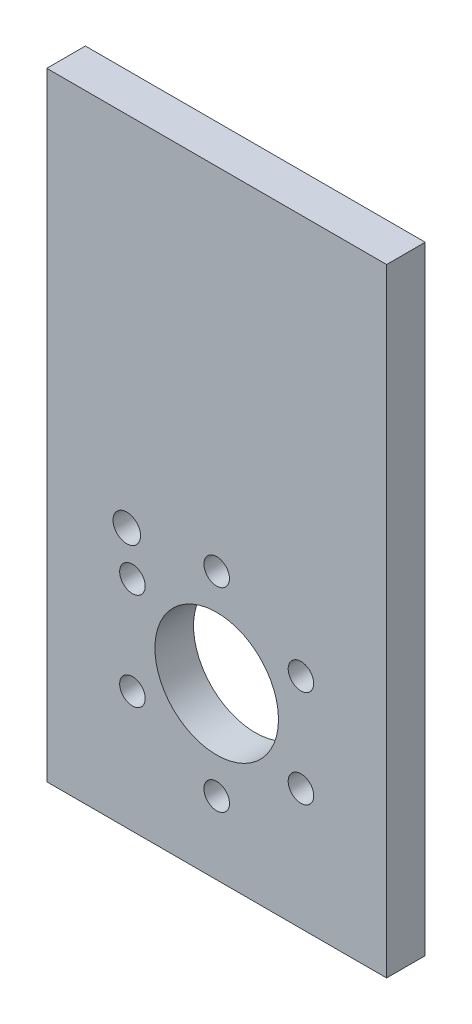
from build123d import *

# Parameters (mm, degrees)
MODEL_W                         = 27.94
MODEL_H                         = 50.8
MODEL_R                         = 1.05
MODEL_R_2                       = 5.08
BOSS_EXTRUDE1_DEPTH             = 3.175
F_43_0_089_DIAMETER_HOLE1_D     = 2.2606
F_43_0_089_DIAMETER_HOLE1_DEPTH = 25.4
F_43_0_089_DIAMETER_HOLE1_TIP   = 0.679152758


with BuildPart() as part:
    # Model → Boss-Extrude1 (new body)
    with BuildSketch(Plane.XY):
        with Locations((0, 11.43)):
            Rectangle(MODEL_W, MODEL_H)
        with Locations((-6.92820323, 4.000000001)):
            Circle(MODEL_R, mode=Mode.SUBTRACT)
        with Locations((-6.92820323, -4.000000001)):
            Circle(MODEL_R, mode=Mode.SUBTRACT)
        with Locations((0, -7.999999999)):
            Circle(MODEL_R, mode=Mode.SUBTRACT)
        with Locations((6.92820323, -4.000000001)):
            Circle(MODEL_R, mode=Mode.SUBTRACT)
        with Locations((6.92820323, 4.000000001)):
            Circle(MODEL_R, mode=Mode.SUBTRACT)
        with Locations((0, 7.999999999)):
            Circle(MODEL_R, mode=Mode.SUBTRACT)
        Circle(MODEL_R_2, mode=Mode.SUBTRACT)
    extrude(amount=BOSS_EXTRUDE1_DEPTH)

    # #43 (0.089) Diameter Hole1
    with Locations(Plane.XY.offset(3.175)):
        with Locations((-7.39143302, 7.395974597)):
            Hole(F_43_0_089_DIAMETER_HOLE1_D / 2, depth=F_43_0_089_DIAMETER_HOLE1_DEPTH)
            with Locations((0, 0, -(F_43_0_089_DIAMETER_HOLE1_DEPTH + F_43_0_089_DIAMETER_HOLE1_TIP / 2))):  # 118° drill point
                Cone(0, F_43_0_089_DIAMETER_HOLE1_D / 2, F_43_0_089_DIAMETER_HOLE1_TIP, mode=Mode.SUBTRACT)


solid = part.part
